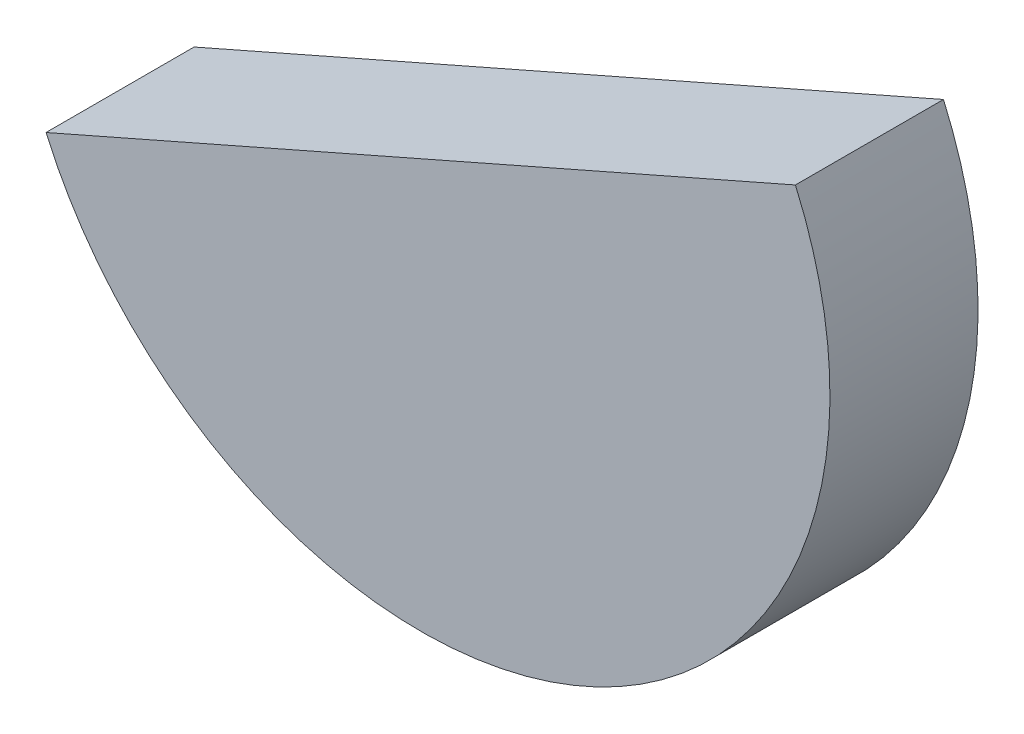
from build123d import *

# Parameters (mm, degrees)
CURVEBOSS_DEPTH = 7.139


with BuildPart() as part:
    # CurveSketch → CurveBoss (new body)
    with BuildSketch(Plane.XY):
        with BuildLine():
            Line((-23.201307673, 5.782177631), (12.927307673, 21.655822369))
            ThreePointArc((12.927307673, 21.655822369), (2.799822369, -4.345307673), (-23.201307673, 5.782177631))
        make_face()
    extrude(amount=CURVEBOSS_DEPTH)


solid = part.part
